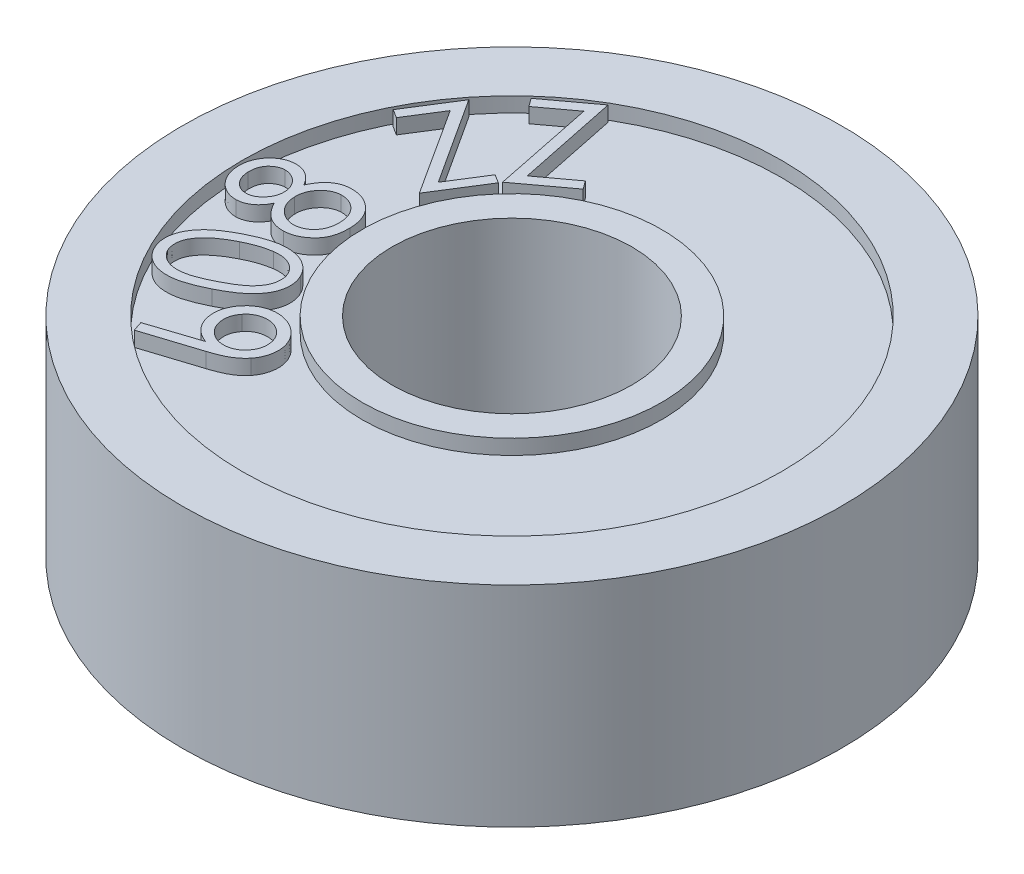
from build123d import *

# Parameters (mm, degrees)
CROQUIS1_R              = 11
CROQUIS1_R_2            = 9
SALIENTE_EXTRUIR1_DEPTH = 7
CROQUIS2_R              = 5
CROQUIS2_R_2            = 4
SALIENTE_EXTRUIR2_DEPTH = 7
SALIENTE_EXTRUIR3_START = 0.5
CROQUIS3_R              = 9
CROQUIS3_R_2            = 5
SALIENTE_EXTRUIR3_DEPTH = 6
SALIENTE_EXTRUIR4_DEPTH = 0.5


with BuildPart() as part:
    # Croquis1 → Saliente-Extruir1 (new body)
    with BuildSketch(Plane(origin=(0, 0, 0), x_dir=(1, 0, 0), z_dir=(0, 1, 0))):
        with Locations(Location((0, 0, 0), (0, 0, 270))):
            Circle(CROQUIS1_R)
        with Locations(Location((0, 0, 0), (0, 0, 270))):
            Circle(CROQUIS1_R_2, mode=Mode.SUBTRACT)
    extrude(amount=SALIENTE_EXTRUIR1_DEPTH)



with BuildPart() as body_2:
    # Croquis2 → Saliente-Extruir2 (new body)
    with BuildSketch(Plane(origin=(0, 0, 0), x_dir=(1, 0, 0), z_dir=(0, 1, 0))):
        with Locations(Location((0, 0, 0), (0, 0, 270))):
            Circle(CROQUIS2_R)
        with Locations(Location((0, 0, 0), (0, 0, 270))):
            Circle(CROQUIS2_R_2, mode=Mode.SUBTRACT)
    extrude(amount=SALIENTE_EXTRUIR2_DEPTH)


with BuildPart() as body_3:
    # Croquis3 → Saliente-Extruir3 (new body)
    with BuildSketch(Plane(origin=(0, 0, 0), x_dir=(1, 0, 0), z_dir=(0, 1, 0)).offset(SALIENTE_EXTRUIR3_START)):
        with Locations(Location((0, 0, 0), (0, 0, 270))):
            Circle(CROQUIS3_R)
        with Locations(Location((0, 0, 0), (0, 0, 270))):
            Circle(CROQUIS3_R_2, mode=Mode.SUBTRACT)
    extrude(amount=SALIENTE_EXTRUIR3_DEPTH)


with BuildPart() as part_1:
    add(part.part)

    add(body_3.part)  # Saliente-Extruir4 merges body 3

    add(body_2.part)  # Saliente-Extruir4 merges body 2
    # Croquis4 → Saliente-Extruir4 (add)
    # profile 1 of 5: a face of its own
    with BuildSketch(Plane(origin=(0, 6.5, 0), x_dir=(1, 0, 0), z_dir=(0, 1, 0))):
        Polygon((-5.771485419, 6.33847571), (-5.972006253, 6.609108723), (-4.493340387, 7.703559845), (-3.792218593, 4.304521383), (-2.678837182, 5.128339492), (-2.476914105, 4.855603114), (-4.022887663, 3.711372345), (-4.717699362, 7.118123146), align=None)
    # profile 2 of 5: a face of its own
    with BuildSketch(Plane(origin=(0, 6.5, 0), x_dir=(1, 0, 0), z_dir=(0, 1, 0))):
        Polygon((-7.660826612, 3.803807011), (-7.944079817, 3.982593069), (-6.969520522, 5.52996887), (-5.094019721, 2.636439223), (-4.360646324, 3.801002524), (-4.075289753, 3.621515345), (-5.094019721, 2.004027364), (-6.966014914, 4.906671595), align=None)
    # profile 3 of 5: a face of its own
    with BuildSketch(Plane(origin=(0, 6.5, 0), x_dir=(1, 0, 0), z_dir=(0, 1, 0))):
        with BuildLine():
            add(Edge.make_bspline(
                [(-7.259020424, 0.313431749), (-7.245266199, 0.342313198), (-7.218469803, 0.398580905), (-7.17469829, 0.478827912), (-7.129671561, 0.553201294), (-7.081475488, 0.620642289), (-7.032659681, 0.682481158), (-6.982122456, 0.738329311), (-6.929455358, 0.787406715), (-6.875154369, 0.830712394), (-6.818475574, 0.867807558), (-6.760394965, 0.901115527), (-6.699681883, 0.928927294), (-6.637429024, 0.953317185), (-6.572635991, 0.970963012), (-6.506260342, 0.985481275), (-6.437516104, 0.994414212), (-6.3908198, 0.997079316), (-6.367193501, 0.998427743)],
                knots=[0, 0, 0, 0, 1.286490489, 2.506379527, 3.675254541, 4.781158289, 5.838198549, 6.842993374, 7.807400337, 8.730849393, 9.632951135, 10.529599687, 11.421207793, 12.316820925, 13.215536738, 14.118959954, 15.048275569, 16, 16, 16, 16], degree=3))
            add(Edge.make_bspline(
                [(-6.367193501, 0.998427743), (-6.334223529, 0.998495375), (-6.26884547, 0.998629485), (-6.172128556, 0.989462301), (-6.078040448, 0.971798023), (-5.986710676, 0.945845034), (-5.897957804, 0.911362888), (-5.812040986, 0.868078661), (-5.728478788, 0.817315642), (-5.676247264, 0.777361093), (-5.649945905, 0.757241846)],
                knots=[0, 0, 0, 0, 1.022841108, 2.028250569, 3.009856065, 3.99025485, 4.97086827, 5.960241633, 6.972872814, 8, 8, 8, 8], degree=3))
            add(Edge.make_bspline(
                [(-5.649945905, 0.757241846), (-5.618835891, 0.730657083), (-5.557087269, 0.677890395), (-5.477576398, 0.585522537), (-5.410004412, 0.48420507), (-5.352646502, 0.374744589), (-5.308740049, 0.25526605), (-5.275100192, 0.127633258), (-5.253025172, -0.009306114), (-5.248449801, -0.103653448), (-5.246099751, -0.152113122)],
                knots=[0, 0, 0, 0, 0.953939032, 1.89342313, 2.832843895, 3.791573494, 4.770203898, 5.796827625, 6.868383333, 8, 8, 8, 8], degree=3))
            add(Edge.make_bspline(
                [(-5.246099751, -0.152113122), (-5.245455056, -0.19888371), (-5.244201883, -0.289797476), (-5.256906673, -0.42202034), (-5.277765733, -0.546197388), (-5.311007297, -0.661760409), (-5.354226129, -0.769000093), (-5.408933988, -0.8674202), (-5.473533179, -0.95785735), (-5.548718118, -1.038476266), (-5.62989461, -1.110189475), (-5.714112151, -1.173435996), (-5.800382058, -1.227955378), (-5.889620644, -1.272203347), (-5.980649879, -1.308455388), (-6.074731256, -1.334268298), (-6.170982975, -1.351617046), (-6.236247264, -1.355427228), (-6.26903645, -1.357341488)],
                knots=[0, 0, 0, 0, 1.267384341, 2.46357142, 3.59602386, 4.677101076, 5.717347382, 6.724287407, 7.72317963, 8.7232169, 9.706244804, 10.656771178, 11.576334147, 12.469019614, 13.3539342, 14.22873984, 15.110107843, 16, 16, 16, 16], degree=3))
            add(Edge.make_bspline(
                [(-6.26903645, -1.357341488), (-6.293121122, -1.357780154), (-6.340663678, -1.358646071), (-6.411131502, -1.352308962), (-6.479822286, -1.342868383), (-6.547004037, -1.328240933), (-6.612069454, -1.307353943), (-6.676280206, -1.283418395), (-6.737834189, -1.252494757), (-6.798922873, -1.218448711), (-6.857808349, -1.177303648), (-6.915690462, -1.130436015), (-6.970887888, -1.07567382), (-7.02566223, -1.015492265), (-7.079135412, -0.948572269), (-7.130704679, -0.874810201), (-7.181572363, -0.794736248), (-7.212821501, -0.737964068), (-7.228872187, -0.708803827)],
                knots=[0, 0, 0, 0, 0.940005932, 1.8555488, 2.759003553, 3.64692924, 4.535979833, 5.425779573, 6.319641813, 7.222958273, 8.154553445, 9.120947569, 10.127737025, 11.187328159, 12.297624475, 13.469950758, 14.700475383, 16, 16, 16, 16], degree=3))
            add(Edge.make_bspline(
                [(-7.228872187, -0.708803827), (-7.250095062, -0.750038994), (-7.291130136, -0.829768443), (-7.367058565, -0.936811512), (-7.451539781, -1.02797902), (-7.543708351, -1.103653548), (-7.642352842, -1.163003558), (-7.745671017, -1.205870371), (-7.852996711, -1.234810524), (-7.926541924, -1.239826695), (-7.963647828, -1.242357513)],
                knots=[0, 0, 0, 0, 1.161957269, 2.246679759, 3.279337034, 4.270733315, 5.227675823, 6.155102324, 7.069190305, 8, 8, 8, 8], degree=3))
            add(Edge.make_bspline(
                [(-7.963647828, -1.242357513), (-8.00138396, -1.241939617), (-8.077558067, -1.241096053), (-8.191178332, -1.217209593), (-8.303736415, -1.177381214), (-8.413730918, -1.121570763), (-8.517853692, -1.050609563), (-8.611907121, -0.964668298), (-8.695283349, -0.865779341), (-8.766028017, -0.75447772), (-8.824730805, -0.63431271), (-8.86603225, -0.506700488), (-8.894877462, -0.374185332), (-8.900366224, -0.283606554), (-8.903151033, -0.237649981)],
                knots=[0, 0, 0, 0, 0.890026714, 1.79660677, 2.727620704, 3.705719647, 4.702981414, 5.696028678, 6.707247124, 7.75054883, 8.805306787, 9.858444042, 10.913447781, 12, 12, 12, 12], degree=3))
            add(Edge.make_bspline(
                [(-8.903151033, -0.237649981), (-8.902865177, -0.192942592), (-8.902300909, -0.104691965), (-8.882003689, 0.025670432), (-8.846028648, 0.151124649), (-8.795015966, 0.270849888), (-8.729967594, 0.381837824), (-8.6533818, 0.48261725), (-8.563967881, 0.570155599), (-8.464627057, 0.644862169), (-8.358068318, 0.70598664), (-8.246331255, 0.750249872), (-8.131490251, 0.77969137), (-8.053326817, 0.785285701), (-8.014128597, 0.788091205)],
                knots=[0, 0, 0, 0, 1.06809724, 2.108381887, 3.143322248, 4.182555268, 5.212123602, 6.212684175, 7.200787032, 8.19458042, 9.178342175, 10.129078266, 11.061750526, 12, 12, 12, 12], degree=3))
            add(Edge.make_bspline(
                [(-8.014128597, 0.788091205), (-7.975706743, 0.787890981), (-7.900135984, 0.787497166), (-7.789751178, 0.766238535), (-7.685487466, 0.730363461), (-7.5872857, 0.67836743), (-7.495713368, 0.609738765), (-7.408864126, 0.526721936), (-7.329423693, 0.426469797), (-7.283054392, 0.352020196), (-7.259020424, 0.313431749)],
                knots=[0, 0, 0, 0, 0.978533749, 1.924647809, 2.852414766, 3.783299697, 4.746895359, 5.763230631, 6.840645833, 8, 8, 8, 8], degree=3))
        make_face()
        with BuildLine():
            add(Edge.make_bspline(
                [(-8.563808085, -0.243960077), (-8.562550576, -0.267365323), (-8.560088479, -0.313190837), (-8.550065546, -0.380010191), (-8.535489274, -0.443683248), (-8.515127735, -0.504321608), (-8.488945829, -0.561530884), (-8.458982649, -0.616216227), (-8.422675467, -0.666965874), (-8.381828147, -0.714163604), (-8.337095449, -0.756454414), (-8.290870036, -0.794155743), (-8.242203241, -0.825282223), (-8.191438082, -0.849745143), (-8.13910556, -0.868949699), (-8.084851874, -0.882435671), (-8.028576759, -0.889450703), (-7.990541636, -0.889611938), (-7.971360168, -0.889693251)],
                knots=[0, 0, 0, 0, 1.152618383, 2.256730381, 3.31935159, 4.36289051, 5.39726759, 6.411314598, 7.425817812, 8.460961476, 9.477547593, 10.45081508, 11.391760144, 12.312250524, 13.217972721, 14.129877394, 15.056879663, 16, 16, 16, 16], degree=3))
            add(Edge.make_bspline(
                [(-7.971360168, -0.889693251), (-7.952139809, -0.888526341), (-7.914094778, -0.886216544), (-7.858134435, -0.874505764), (-7.80376515, -0.856998781), (-7.75116891, -0.832699995), (-7.699378435, -0.803533187), (-7.650575719, -0.766302745), (-7.602259375, -0.724150567), (-7.5569152, -0.675438107), (-7.514599095, -0.623187202), (-7.477878154, -0.567970118), (-7.446658152, -0.511151776), (-7.422223198, -0.451782139), (-7.403020054, -0.390849058), (-7.390645106, -0.327830341), (-7.383100452, -0.263076625), (-7.383578129, -0.219207556), (-7.383820104, -0.196984917)],
                knots=[0, 0, 0, 0, 0.921889866, 1.824800851, 2.731663933, 3.654098088, 4.597514622, 5.574323409, 6.590174507, 7.667880198, 8.759525933, 9.80963287, 10.842207172, 11.861572589, 12.881983794, 13.899131053, 14.935768356, 16, 16, 16, 16], degree=3))
            add(Edge.make_bspline(
                [(-7.383820104, -0.196984917), (-7.385667237, -0.168620528), (-7.389351341, -0.112047817), (-7.407800455, -0.028865086), (-7.438091683, 0.051049736), (-7.476934783, 0.12772054), (-7.524700315, 0.199315503), (-7.582301187, 0.261844971), (-7.646365126, 0.316799736), (-7.717911247, 0.360722156), (-7.791808017, 0.396509308), (-7.867227802, 0.421391442), (-7.942485852, 0.436157331), (-7.992798143, 0.437076547), (-8.017634206, 0.437530307)],
                knots=[0, 0, 0, 0, 1.030701838, 2.05573255, 3.078408604, 4.125527344, 5.17020344, 6.191083501, 7.202331067, 8.223845368, 9.229383657, 10.176355134, 11.099779436, 12, 12, 12, 12], degree=3))
            add(Edge.make_bspline(
                [(-8.017634206, 0.437530307), (-8.034974999, 0.436532235), (-8.069677021, 0.434534913), (-8.120836331, 0.424266626), (-8.170826933, 0.409527611), (-8.219961012, 0.389863837), (-8.267309618, 0.363612403), (-8.313756119, 0.332670574), (-8.358884021, 0.296659132), (-8.40214573, 0.255666465), (-8.441957306, 0.20950501), (-8.477580434, 0.15897288), (-8.506260938, 0.102884623), (-8.529342859, 0.042425265), (-8.546873933, -0.022643229), (-8.558867872, -0.092328854), (-8.564093903, -0.166752532), (-8.563905002, -0.217779884), (-8.563808085, -0.243960077)],
                knots=[0, 0, 0, 0, 0.853787771, 1.708581775, 2.560042933, 3.416382677, 4.306643915, 5.218843106, 6.15994246, 7.14417822, 8.147048901, 9.155114986, 10.178673664, 11.237979217, 12.33433971, 13.48949643, 14.71195612, 16, 16, 16, 16], degree=3))
        make_face(mode=Mode.SUBTRACT)
        with BuildLine():
            add(Edge.make_bspline(
                [(-7.069016418, -0.182962481), (-7.067448618, -0.21246119), (-7.064372915, -0.270331593), (-7.05071852, -0.354792894), (-7.030602586, -0.43546937), (-7.002198706, -0.51211279), (-6.967275648, -0.585299369), (-6.924677142, -0.654369234), (-6.87566329, -0.720101653), (-6.818913435, -0.780083848), (-6.758627549, -0.835509691), (-6.694700375, -0.882985218), (-6.629063919, -0.923722159), (-6.560983306, -0.955861691), (-6.490719711, -0.980658939), (-6.418473531, -0.998447587), (-6.343603124, -1.007697552), (-6.293130568, -1.007554151), (-6.267634206, -1.007481712)],
                knots=[0, 0, 0, 0, 1.109609485, 2.176825732, 3.210099748, 4.229995053, 5.243629664, 6.252992466, 7.27545678, 8.319613335, 9.35187875, 10.349747777, 11.3078934, 12.250900592, 13.173267115, 14.104292983, 15.042377964, 16, 16, 16, 16], degree=3))
            add(Edge.make_bspline(
                [(-6.267634206, -1.007481712), (-6.236177495, -1.005416889), (-6.173438979, -1.001298723), (-6.081539699, -0.977621712), (-5.992369937, -0.942681009), (-5.908024533, -0.893961274), (-5.829257456, -0.834922018), (-5.760174083, -0.76394854), (-5.700677136, -0.683420169), (-5.652337421, -0.592822984), (-5.614591565, -0.494142275), (-5.58864827, -0.387707356), (-5.574399229, -0.274506344), (-5.574747603, -0.196790044), (-5.574925873, -0.157020975)],
                knots=[0, 0, 0, 0, 0.923836093, 1.842535392, 2.772746259, 3.728572981, 4.69339736, 5.654186896, 6.62589263, 7.623729995, 8.659813519, 9.719977463, 10.833264393, 12, 12, 12, 12], degree=3))
            add(Edge.make_bspline(
                [(-5.574925873, -0.157020975), (-5.576465499, -0.126116472), (-5.579476436, -0.065678762), (-5.593398339, 0.022157807), (-5.612225996, 0.105356023), (-5.640216447, 0.182792293), (-5.673686423, 0.255637144), (-5.714704749, 0.32327483), (-5.76234298, 0.386117975), (-5.817352789, 0.442258727), (-5.875445288, 0.493346588), (-5.937135867, 0.536855612), (-6.00004495, 0.57454202), (-6.065988984, 0.604169151), (-6.133947188, 0.626525895), (-6.204144426, 0.642120694), (-6.276291511, 0.650753499), (-6.325104386, 0.650698837), (-6.349665456, 0.650671333)],
                knots=[0, 0, 0, 0, 1.186697622, 2.320739047, 3.408505911, 4.455305422, 5.474536341, 6.480539479, 7.485142193, 8.493740957, 9.491916719, 10.450122801, 11.386932731, 12.302197928, 13.218341668, 14.127964101, 15.058051665, 16, 16, 16, 16], degree=3))
            add(Edge.make_bspline(
                [(-6.349665456, 0.650671333), (-6.373565289, 0.649361602), (-6.421013045, 0.646761427), (-6.49086473, 0.632974883), (-6.558306714, 0.611963698), (-6.623417524, 0.583330572), (-6.686759392, 0.548524586), (-6.747384696, 0.505145817), (-6.805494518, 0.454352531), (-6.861033288, 0.397548334), (-6.911817636, 0.335696258), (-6.956335942, 0.270439008), (-6.99318002, 0.201777412), (-7.022202578, 0.130116984), (-7.046087378, 0.056033494), (-7.061220363, -0.021137522), (-7.068959378, -0.101230195), (-7.068997161, -0.155369011), (-7.069016418, -0.182962481)],
                knots=[0, 0, 0, 0, 0.941651404, 1.869437579, 2.795121482, 3.718423141, 4.665992991, 5.636395933, 6.647663087, 7.702029134, 8.761444434, 9.795284986, 10.808226009, 11.823464096, 12.83644693, 13.868893668, 14.913817802, 16, 16, 16, 16], degree=3))
        make_face(mode=Mode.SUBTRACT)
    # profile 4 of 5: a face of its own
    with BuildSketch(Plane(origin=(0, 6.5, 0), x_dir=(1, 0, 0), z_dir=(0, 1, 0))):
        with BuildLine():
            add(Edge.make_bspline(
                [(-5.785473416, -4.226144193), (-5.835376026, -4.250446229), (-5.932300149, -4.297647237), (-6.075059932, -4.362494171), (-6.211798575, -4.417980953), (-6.341577538, -4.465971312), (-6.46518161, -4.504670588), (-6.581982241, -4.534876155), (-6.692035456, -4.558157333), (-6.796429205, -4.571164389), (-6.895715514, -4.577785693), (-6.991009766, -4.577563293), (-7.083128125, -4.572472496), (-7.171518338, -4.559966458), (-7.256920237, -4.543970367), (-7.338478637, -4.519459358), (-7.417066956, -4.490213123), (-7.492251796, -4.455294239), (-7.562864859, -4.414275625), (-7.629902129, -4.369710911), (-7.691644037, -4.319480068), (-7.749276595, -4.265362324), (-7.803035739, -4.207188593), (-7.85109792, -4.143597537), (-7.896018279, -4.076366696), (-7.921059693, -4.028214856), (-7.933710596, -4.003888584)],
                knots=[0, 0, 0, 0, 1.644850028, 3.194735704, 4.645463619, 6.01704411, 7.294110131, 8.481731755, 9.59143234, 10.624857081, 11.596465088, 12.538368593, 13.447333508, 14.32788622, 15.182228747, 16.019415478, 16.847847677, 17.665820815, 18.472456449, 19.265781143, 20.048882309, 20.827930384, 21.607347792, 22.392773069, 23.1880302, 24, 24, 24, 24], degree=3))
            add(Edge.make_bspline(
                [(-7.933710596, -4.003888584), (-7.945478561, -3.978790181), (-7.968802149, -3.92904625), (-7.998006291, -3.852419003), (-8.019196476, -3.774302343), (-8.036031505, -3.695751903), (-8.044546574, -3.615907053), (-8.048675438, -3.535308576), (-8.044502867, -3.453764529), (-8.035752923, -3.371442111), (-8.019803076, -3.288739978), (-7.995448879, -3.20670161), (-7.965266965, -3.1248277), (-7.927955633, -3.043539176), (-7.883771564, -2.962488993), (-7.831248496, -2.882807525), (-7.773222263, -2.802648393), (-7.707685505, -2.723044089), (-7.633497337, -2.643831596), (-7.549533131, -2.566019833), (-7.456176415, -2.488289624), (-7.35338154, -2.411628687), (-7.240663728, -2.335490684), (-7.117842187, -2.261422523), (-6.986785413, -2.185338497), (-6.894424791, -2.138453757), (-6.846971814, -2.114365347)],
                knots=[0, 0, 0, 0, 0.815702621, 1.616686655, 2.409359038, 3.195770111, 3.97811016, 4.769827084, 5.568415569, 6.378093437, 7.204970587, 8.042986162, 8.893886422, 9.771067033, 10.672950552, 11.607751081, 12.57764623, 13.584233529, 14.640157302, 15.769154917, 16.950970162, 18.213771182, 19.541491878, 20.952303053, 22.434156318, 24, 24, 24, 24], degree=3))
            add(Edge.make_bspline(
                [(-6.846971814, -2.114365347), (-6.799465104, -2.090872925), (-6.706839589, -2.045068918), (-6.568789907, -1.984115774), (-6.435913259, -1.931797651), (-6.309233981, -1.885233592), (-6.186813645, -1.849093758), (-6.069956921, -1.819879881), (-5.957992963, -1.799429888), (-5.851198548, -1.786711222), (-5.748620767, -1.78098475), (-5.650057843, -1.781804889), (-5.554936803, -1.787801354), (-5.463532259, -1.80040292), (-5.375908331, -1.819301728), (-5.291879721, -1.844155741), (-5.21114145, -1.873815298), (-5.134819589, -1.910684765), (-5.062272686, -1.951955329), (-4.994368331, -1.998533481), (-4.930134287, -2.04856557), (-4.87194493, -2.1046522), (-4.817773755, -2.164343663), (-4.767697612, -2.228280513), (-4.722661387, -2.297023588), (-4.696950848, -2.345750964), (-4.684011077, -2.370274802)],
                knots=[0, 0, 0, 0, 1.560832901, 3.043211213, 4.442862328, 5.766660347, 7.016713183, 8.200377912, 9.312893889, 10.366481493, 11.366092518, 12.336676409, 13.267998219, 14.171377347, 15.051645604, 15.905464788, 16.750582686, 17.581879778, 18.398948415, 19.206538823, 20.005280275, 20.794023074, 21.583486405, 22.377975168, 23.18365655, 24, 24, 24, 24], degree=3))
            add(Edge.make_bspline(
                [(-4.684011077, -2.370274802), (-4.672141333, -2.39486606), (-4.648565302, -2.443709933), (-4.620836459, -2.519618854), (-4.598894254, -2.596218314), (-4.583424934, -2.673599948), (-4.57426806, -2.751676815), (-4.571481785, -2.830692438), (-4.575031241, -2.910632566), (-4.584921229, -2.99125328), (-4.600890318, -3.071993843), (-4.624148904, -3.152209301), (-4.654685159, -3.231443426), (-4.690929679, -3.310581244), (-4.735849779, -3.388219005), (-4.785950917, -3.466007419), (-4.843402005, -3.543004837), (-4.907973115, -3.619584894), (-4.981484816, -3.6959894), (-5.065536439, -3.771571841), (-5.159210506, -3.847838387), (-5.263957719, -3.923919692), (-5.379110135, -3.999862172), (-5.505317225, -4.07543934), (-5.64114563, -4.152132798), (-5.73644962, -4.201004754), (-5.785473416, -4.226144193)],
                knots=[0, 0, 0, 0, 0.809645163, 1.608140826, 2.393831572, 3.171589882, 3.946437896, 4.723454188, 5.514601714, 6.317809193, 7.130920153, 7.953756999, 8.792018043, 9.648152047, 10.533055414, 11.45036591, 12.391907078, 13.380833891, 14.420355349, 15.534535636, 16.732138656, 18.002414497, 19.373476209, 20.822918295, 22.365728375, 24, 24, 24, 24], degree=3))
        make_face()
        with BuildLine():
            add(Edge.make_bspline(
                [(-5.926398897, -3.930270796), (-5.884205931, -3.908775071), (-5.802306712, -3.867050508), (-5.685502621, -3.802571373), (-5.578108943, -3.739580145), (-5.48015865, -3.677904342), (-5.391926254, -3.616841293), (-5.312314767, -3.557637796), (-5.242805134, -3.498810582), (-5.182353477, -3.44053301), (-5.129275247, -3.382616548), (-5.082243234, -3.324120854), (-5.039682608, -3.265301355), (-5.003512202, -3.205064191), (-4.972297842, -3.144520891), (-4.94671948, -3.08315216), (-4.927445553, -3.020814796), (-4.907692004, -2.938508999), (-4.896596941, -2.836618446), (-4.899824762, -2.717824284), (-4.923566261, -2.604548862), (-4.954102468, -2.535300838), (-4.969367647, -2.500683456)],
                knots=[0, 0, 0, 0, 1.477156234, 2.867253755, 4.1614271, 5.360868836, 6.477218534, 7.50813858, 8.45473593, 9.315822226, 10.126019982, 10.903712831, 11.656326751, 12.389043008, 13.093350821, 13.779809674, 14.460045543, 15.126745186, 16.418184279, 17.643819462, 18.822135333, 20, 20, 20, 20], degree=3))
            add(Edge.make_bspline(
                [(-4.969367647, -2.500683456), (-4.987763224, -2.4673468), (-5.024454027, -2.400855346), (-5.102184069, -2.315734692), (-5.192566213, -2.240973864), (-5.280082255, -2.190782653), (-5.356120851, -2.157695564), (-5.417046218, -2.137003937), (-5.480980712, -2.122053538), (-5.547639443, -2.110287072), (-5.617347354, -2.105394599), (-5.689700144, -2.103478186), (-5.764859185, -2.108151024), (-5.815648651, -2.114122821), (-5.84156316, -2.117169834)],
                knots=[0, 0, 0, 0, 1.339242649, 2.671179428, 4.036369644, 5.466270955, 6.212300305, 6.960695697, 7.732704996, 8.527113635, 9.346134784, 10.195639226, 11.07935391, 12, 12, 12, 12], degree=3))
            add(Edge.make_bspline(
                [(-5.84156316, -2.117169834), (-5.874335721, -2.121990856), (-5.941123541, -2.131815707), (-6.042062987, -2.15291101), (-6.144976295, -2.180762), (-6.250686719, -2.212795396), (-6.358383008, -2.251580612), (-6.468663909, -2.295999432), (-6.581510636, -2.345528333), (-6.656630851, -2.38238373), (-6.694828384, -2.401124161)],
                knots=[0, 0, 0, 0, 0.879907301, 1.793179635, 2.737457113, 3.711595274, 4.726909887, 5.777253635, 6.869765893, 8, 8, 8, 8], degree=3))
            add(Edge.make_bspline(
                [(-6.694828384, -2.401124161), (-6.732838729, -2.42047326), (-6.806942526, -2.458195668), (-6.913121266, -2.518241898), (-7.012424075, -2.578424136), (-7.105612876, -2.63839939), (-7.190820138, -2.700567126), (-7.270411424, -2.761605405), (-7.34212695, -2.824538584), (-7.407344166, -2.887326823), (-7.465774926, -2.950630086), (-7.517744764, -3.013999515), (-7.564200522, -3.076596776), (-7.603747196, -3.139789027), (-7.637820874, -3.202471651), (-7.664067091, -3.265952404), (-7.685888841, -3.328737864), (-7.704610782, -3.411462608), (-7.716775095, -3.512553897), (-7.711383796, -3.630182357), (-7.690533738, -3.742637411), (-7.660017156, -3.811303511), (-7.644848416, -3.845435059)],
                knots=[0, 0, 0, 0, 1.3313534, 2.595565593, 3.806751591, 4.956154054, 6.053628255, 7.098554951, 8.08618257, 9.030386223, 9.923604425, 10.77367924, 11.587934428, 12.355101387, 13.099270099, 13.812018826, 14.497239008, 15.171496212, 16.456567233, 17.661452386, 18.837588712, 20, 20, 20, 20], degree=3))
            add(Edge.make_bspline(
                [(-7.644848416, -3.845435059), (-7.626223034, -3.878787284), (-7.589057009, -3.945339993), (-7.51038989, -4.030396957), (-7.419449522, -4.105998393), (-7.330998821, -4.156841131), (-7.253743357, -4.189685079), (-7.192296734, -4.211214606), (-7.127938047, -4.227008395), (-7.060921283, -4.23839465), (-6.991290126, -4.244354212), (-6.919179122, -4.246655714), (-6.844236505, -4.243632337), (-6.766031939, -4.235828909), (-6.682727283, -4.222575379), (-6.594047797, -4.200762615), (-6.498329642, -4.173793745), (-6.396772372, -4.137878249), (-6.288090737, -4.096784506), (-6.172953776, -4.048307506), (-6.051789805, -3.991772802), (-5.96909762, -3.951213759), (-5.926398897, -3.930270796)],
                knots=[0, 0, 0, 0, 1.187475118, 2.369547652, 3.586428317, 4.866512347, 5.532582873, 6.203302538, 6.894460428, 7.596598236, 8.321113264, 9.072124326, 9.845231734, 10.658193408, 11.522092735, 12.473178203, 13.504334428, 14.622200536, 15.830956675, 17.127717408, 18.51687557, 20, 20, 20, 20], degree=3))
        make_face(mode=Mode.SUBTRACT)
    # profile 5 of 5: a face of its own
    with BuildSketch(Plane(origin=(0, 6.5, 0), x_dir=(1, 0, 0), z_dir=(0, 1, 0))):
        with BuildLine():
            Line((-5.892771279, -6.710839558), (-6.000744035, -6.385519045))
            Line((-6.000744035, -6.385519045), (-4.373440349, -5.849861994))
            add(Edge.make_bspline(
                [(-4.373440349, -5.849861994), (-4.403804491, -5.838202125), (-4.462873069, -5.815519716), (-4.545939987, -5.774030681), (-4.623042238, -5.730130311), (-4.669181832, -5.695181384), (-4.691749644, -5.678087154)],
                knots=[0, 0, 0, 0, 1.074052823, 2.089397862, 3.065485677, 4, 4, 4, 4], degree=3))
            add(Edge.make_bspline(
                [(-4.691749644, -5.678087154), (-4.717908029, -5.656142607), (-4.769285722, -5.613041311), (-4.837827601, -5.540602362), (-4.897559162, -5.463754949), (-4.94790974, -5.381341318), (-4.989185429, -5.294061373), (-5.022526598, -5.202182271), (-5.045426096, -5.104946771), (-5.059867615, -5.00430489), (-5.065967325, -4.902191064), (-5.060549009, -4.801260592), (-5.046954191, -4.702247069), (-5.022137743, -4.60581615), (-4.988082561, -4.511448304), (-4.944476599, -4.419259723), (-4.890476066, -4.329433626), (-4.84791557, -4.272912567), (-4.826365029, -4.244293084)],
                knots=[0, 0, 0, 0, 1.02061948, 2.004599131, 2.976385378, 3.927125114, 4.887072207, 5.859989242, 6.845085684, 7.869289902, 8.898420552, 9.899265362, 10.88787763, 11.883116108, 12.871555353, 13.884702068, 14.928917194, 16, 16, 16, 16], degree=3))
            add(Edge.make_bspline(
                [(-4.826365029, -4.244293084), (-4.794593122, -4.206701923), (-4.732201446, -4.132882762), (-4.623442158, -4.038849139), (-4.505489111, -3.962056102), (-4.379534365, -3.901292727), (-4.246766979, -3.858392066), (-4.108961882, -3.834193926), (-3.967340593, -3.830321518), (-3.824261311, -3.845552753), (-3.682634922, -3.876944672), (-3.547001782, -3.927687717), (-3.417908296, -3.99388346), (-3.339975681, -4.051308026), (-3.300724003, -4.080230584)],
                knots=[0, 0, 0, 0, 1.034409437, 2.03130827, 3.011968445, 3.988514386, 4.96512223, 5.938493451, 6.922427714, 7.935782263, 8.959334541, 9.965973342, 10.975538564, 12, 12, 12, 12], degree=3))
            add(Edge.make_bspline(
                [(-3.300724003, -4.080230584), (-3.264756445, -4.11060159), (-3.193410709, -4.170845928), (-3.103088111, -4.277301578), (-3.026915303, -4.393518509), (-2.967171696, -4.519340906), (-2.923425583, -4.651391056), (-2.898550436, -4.787768671), (-2.892836014, -4.927029095), (-2.907392426, -5.067206069), (-2.938767008, -5.204951628), (-2.986582917, -5.337041789), (-3.051318797, -5.461958164), (-3.106657503, -5.537590905), (-3.134558138, -5.575723372)],
                knots=[0, 0, 0, 0, 1.010269405, 2.003984048, 2.987542335, 3.989537075, 4.988619492, 5.96888905, 6.959195847, 7.973763787, 8.988741937, 9.988177815, 10.985680753, 12, 12, 12, 12], degree=3))
            add(Edge.make_bspline(
                [(-3.134558138, -5.575723372), (-3.157858563, -5.603337385), (-3.20538299, -5.659659967), (-3.288411806, -5.736255235), (-3.380402826, -5.809641899), (-3.484782384, -5.878592547), (-3.604650837, -5.944762153), (-3.744119999, -6.007607557), (-3.903688225, -6.071230787), (-4.018439815, -6.108990765), (-4.078969196, -6.128908468)],
                knots=[0, 0, 0, 0, 0.779975685, 1.590867834, 2.435458769, 3.320557647, 4.290174334, 5.39050715, 6.623539888, 8, 8, 8, 8], degree=3))
            Line((-4.078969196, -6.128908468), (-5.892771279, -6.710839558))
        make_face()
        with BuildLine():
            add(Edge.make_bspline(
                [(-4.436541311, -5.490186513), (-4.416706646, -5.505056989), (-4.377331549, -5.534577348), (-4.314411972, -5.571620603), (-4.24913597, -5.601099096), (-4.182481199, -5.624883525), (-4.113379906, -5.639682139), (-4.042587886, -5.649544814), (-3.969746225, -5.6501736), (-3.895802884, -5.645719569), (-3.822641376, -5.633571371), (-3.751691322, -5.615917217), (-3.684856215, -5.590041845), (-3.620938902, -5.559193671), (-3.560697343, -5.521380984), (-3.504350551, -5.476437686), (-3.45060362, -5.4263746), (-3.419043946, -5.388195366), (-3.403087785, -5.368892443)],
                knots=[0, 0, 0, 0, 1.02728207, 2.039325205, 3.019270681, 3.993739679, 4.966955341, 5.944070331, 6.951976685, 7.981313093, 9.011971238, 10.022528941, 11.006919503, 11.977623636, 12.961584907, 13.948261873, 14.96266792, 16, 16, 16, 16], degree=3))
            add(Edge.make_bspline(
                [(-3.403087785, -5.368892443), (-3.388209202, -5.349060188), (-3.358672747, -5.309689876), (-3.321747582, -5.246735194), (-3.291867835, -5.181656755), (-3.269747886, -5.114770092), (-3.252798884, -5.046185781), (-3.245178788, -4.975306387), (-3.242468339, -4.902557098), (-3.248658405, -4.828896353), (-3.260117128, -4.755865537), (-3.278557626, -4.685223445), (-3.302899639, -4.617949764), (-3.333908717, -4.554082496), (-3.372218362, -4.494636319), (-3.415794435, -4.437843366), (-3.466450239, -4.385315622), (-3.503997495, -4.353584193), (-3.522979612, -4.337542283)],
                knots=[0, 0, 0, 0, 1.030044177, 2.044808445, 3.027388752, 4.001333048, 4.969883375, 5.95806766, 6.959205914, 7.99199566, 9.025424989, 10.029293839, 11.022052635, 11.995366751, 12.973759188, 13.957107735, 14.967210254, 16, 16, 16, 16], degree=3))
            add(Edge.make_bspline(
                [(-3.522979612, -4.337542283), (-3.542811947, -4.322664066), (-3.582182419, -4.29312834), (-3.645135929, -4.256197828), (-3.710218661, -4.22633766), (-3.777305731, -4.204074049), (-3.845952428, -4.18742155), (-3.917022166, -4.179542154), (-3.989784916, -4.17693628), (-4.063678001, -4.183098513), (-4.136700942, -4.19459543), (-4.207161644, -4.212878694), (-4.274123509, -4.237476636), (-4.337571672, -4.268467858), (-4.397451159, -4.305864962), (-4.453996555, -4.349598184), (-4.506564769, -4.400190546), (-4.538290661, -4.437746482), (-4.554329772, -4.456732988)],
                knots=[0, 0, 0, 0, 1.030351805, 2.045419137, 3.028292896, 4.002528066, 4.980826598, 5.959655988, 6.970807727, 8.003905921, 9.037643889, 10.041812549, 11.0257428, 11.999347601, 12.972855386, 13.956497615, 14.966901806, 16, 16, 16, 16], degree=3))
            add(Edge.make_bspline(
                [(-4.554329772, -4.456732988), (-4.569471362, -4.476780419), (-4.599336031, -4.516321177), (-4.636405666, -4.57992096), (-4.666920389, -4.645033094), (-4.689254995, -4.712466608), (-4.705610819, -4.781387629), (-4.714956438, -4.852584115), (-4.715765456, -4.925627348), (-4.711214828, -4.999563436), (-4.699306143, -5.072561692), (-4.68106365, -5.142991511), (-4.656661778, -5.210178816), (-4.624654666, -5.273237352), (-4.587465196, -5.333335744), (-4.54366071, -5.389845617), (-4.493087748, -5.442423502), (-4.455529158, -5.474148071), (-4.436541311, -5.490186513)],
                knots=[0, 0, 0, 0, 1.041272982, 2.053765455, 3.047001832, 4.018765719, 4.994582661, 5.981745301, 6.990099156, 8.01989258, 9.051008328, 10.052629775, 11.03406415, 12.009495812, 12.980534159, 13.961681243, 14.969522403, 16, 16, 16, 16], degree=3))
        make_face(mode=Mode.SUBTRACT)
    extrude(amount=SALIENTE_EXTRUIR4_DEPTH)


solid = part_1.part
